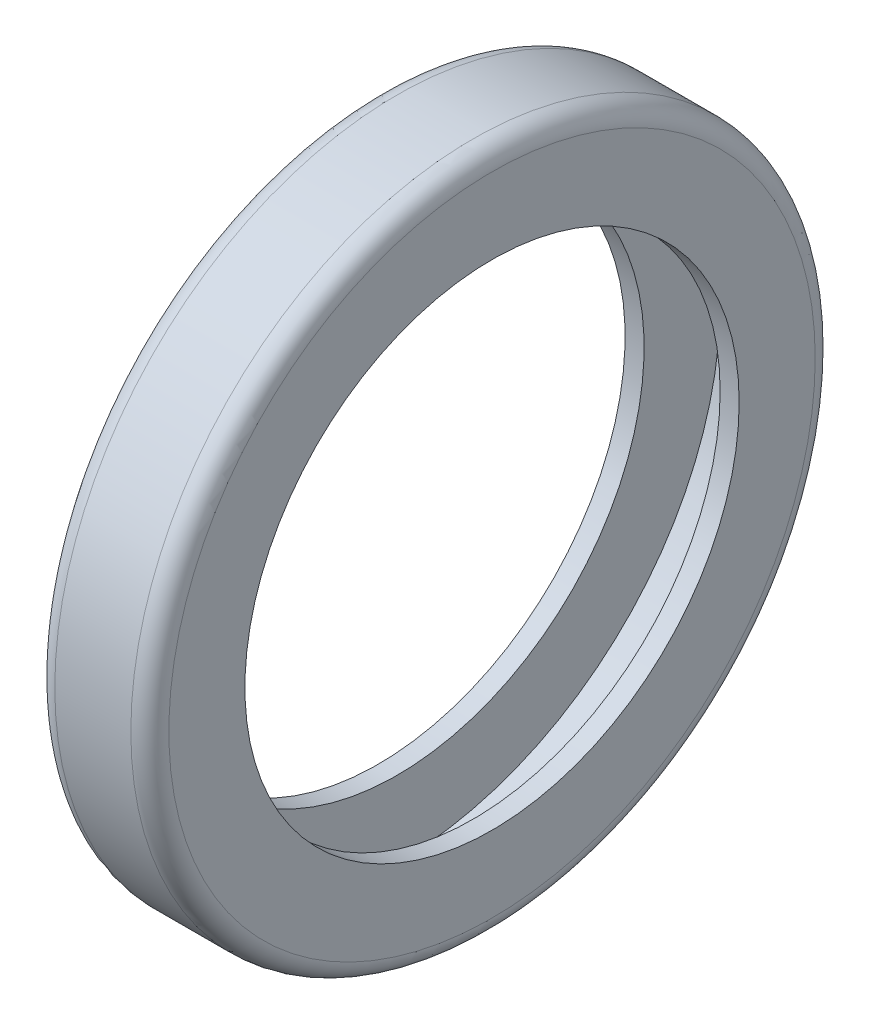
from build123d import *

# Parameters (mm, degrees)
ESQUISSE1_R        = 21.6
ESQUISSE1_R_2      = 20.4
BOSS_EXTRU_3_DEPTH = 7.2
BOSS_EXTRU_4_START = -1.2
ESQUISSE4_R        = 20.4
ESQUISSE4_R_2      = 15.6
BOSS_EXTRU_4_DEPTH = 1.2
ESQUISSE5_R        = 20.4
ESQUISSE5_R_2      = 15.6
BOSS_EXTRU_5_DEPTH = 1.2
CONG_3_R           = 1.2


with BuildPart() as part:
    # Esquisse1 → Boss.-Extru.3 (new body)
    with BuildSketch(Plane(origin=(0, 0, 0), x_dir=(0, 0, -1), z_dir=(1, 0, 0))):
        Circle(ESQUISSE1_R)
        Circle(ESQUISSE1_R_2, mode=Mode.SUBTRACT)
    extrude(amount=BOSS_EXTRU_3_DEPTH)

    # Esquisse4 → Boss.-Extru.4 (add)
    with BuildSketch(Plane(origin=(7.2, 0, 0), x_dir=(0, 0, -1), z_dir=(1, 0, 0)).offset(BOSS_EXTRU_4_START)):
        Circle(ESQUISSE4_R)
        Circle(ESQUISSE4_R_2, mode=Mode.SUBTRACT)
    extrude(amount=BOSS_EXTRU_4_DEPTH)

    # Esquisse5 → Boss.-Extru.5 (add)
    with BuildSketch(Plane.ZY):
        Circle(ESQUISSE5_R)
        with Locations(Location((0, 0, 0), (0, 0, 180))):
            Circle(ESQUISSE5_R_2, mode=Mode.SUBTRACT)
    extrude(amount=-BOSS_EXTRU_5_DEPTH)

    # Congé3
    cong_3_edges = [part.edges().sort_by_distance(p)[0] for p in [
        (0, 0, 21.6),
        (7.2, 0, 21.6),
    ]]
    fillet(cong_3_edges, radius=CONG_3_R)


solid = part.part
